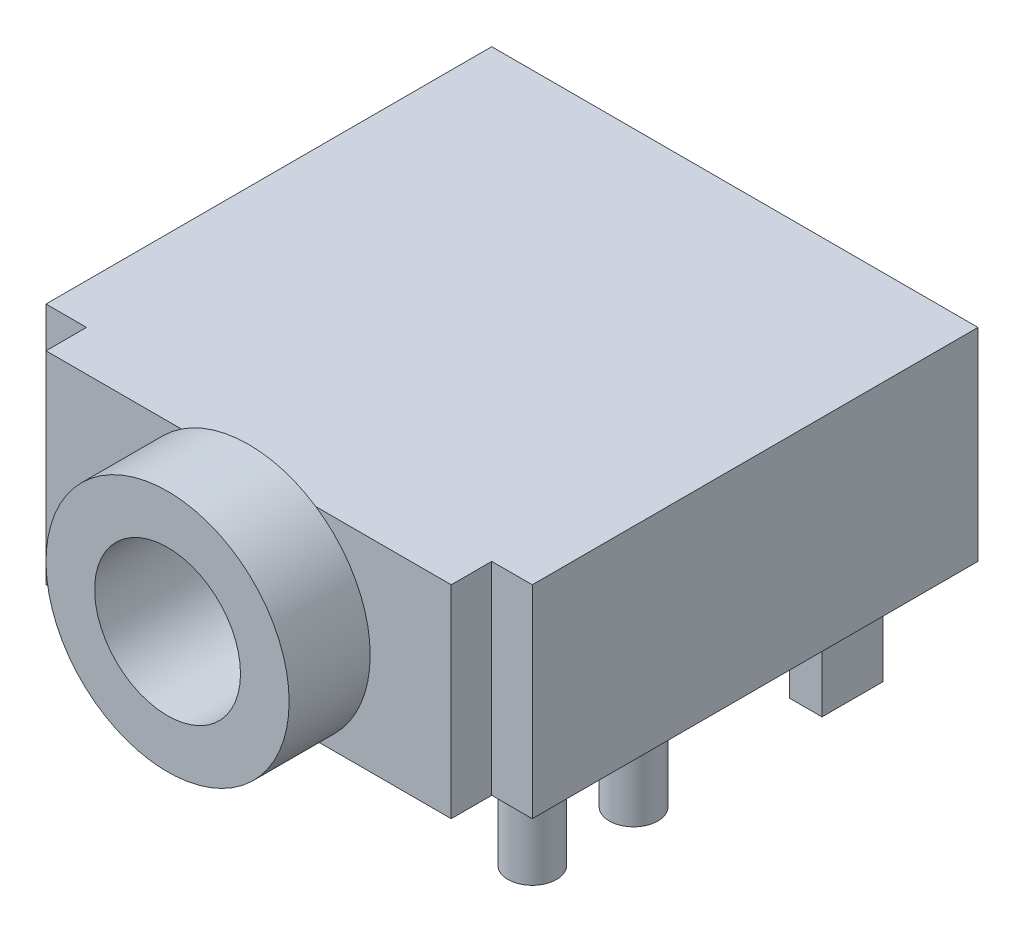
from build123d import *

# Parameters (mm, degrees)
SKETCH_1_W          = 12
SKETCH_1_H          = 5
EXTRUDE_1_DEPTH     = 11
SKETCH_2_R          = 0.6
EXTRUDE_2_DEPTH     = 2
EXTRUDE_2_2_DEPTH   = 2
EXTRUDE_2_3_DEPTH   = 2
EXTRUDE_2_4_DEPTH   = 2
SKETCH_2_W          = 0.8
SKETCH_2_H          = 1.5
EXTRUDE_2_5_DEPTH   = 2
EXTRUDE_2_6_DEPTH   = 2
SKETCH_2_W_2        = 1.5
SKETCH_2_H_2        = 0.8
EXTRUDE_2_7_DEPTH   = 2
EXTRUDE_2_8_DEPTH   = 2
EXTRUDE_2_9_DEPTH   = 2
SKETCH_3_W          = 10
SKETCH_3_H          = 5
EXTRUDE_3_DEPTH     = 1
SKETCH_4_R          = 3
EXTRUDE_4_DEPTH     = 2
SKETCH_5_R          = 1.8
CUT_EXTRUDE_1_DEPTH = 14


with BuildPart() as part:
    # Эскиз1 → Бобышка-Вытянуть1 (new body)
    with BuildSketch(Plane.XY):
        with Locations((0, 2.5)):
            Rectangle(SKETCH_1_W, SKETCH_1_H)
    extrude(amount=EXTRUDE_1_DEPTH)

    # Эскиз3 → Бобышка-Вытянуть3 (add)
    with BuildSketch(Plane.XY.offset(11)):
        with Locations((0, 2.5)):
            Rectangle(SKETCH_3_W, SKETCH_3_H)
    extrude(amount=EXTRUDE_3_DEPTH)

    # Эскиз4 → Бобышка-Вытянуть4 (add)
    with BuildSketch(Plane.XY.offset(12)):
        with Locations(Location((0, 2.5, 0), (0, 0, 123.557309762))):
            Circle(SKETCH_4_R)
    extrude(amount=EXTRUDE_4_DEPTH)

    # Эскиз5 → Вырез-Вытянуть1 (cut)
    with BuildSketch(Plane.XY.offset(14)):
        with Locations((0, 2.5)):
            Circle(SKETCH_5_R)
    extrude(amount=-CUT_EXTRUDE_1_DEPTH, mode=Mode.SUBTRACT)


with BuildPart() as body_2:
    # Эскиз2 → Бобышка-Вытянуть2 (new body)
    with BuildSketch(Plane(origin=(0, 0, 0), x_dir=(1, 0, 0), z_dir=(0, 1, 0))):
        with Locations(Location((5, -10, 0), (0, 0, 270))):
            Circle(SKETCH_2_R)
    extrude(amount=-EXTRUDE_2_DEPTH)


with BuildPart() as body_3:
    # Эскиз2 → Extrude 2 2 (new body)
    with BuildSketch(Plane(origin=(0, 0, 0), x_dir=(1, 0, 0), z_dir=(0, 1, 0))):
        with Locations(Location((5, -7.5, 0), (0, 0, 270))):
            Circle(SKETCH_2_R)
    extrude(amount=-EXTRUDE_2_2_DEPTH)


with BuildPart() as body_4:
    # Эскиз2 → Extrude 2 3 (new body)
    with BuildSketch(Plane(origin=(0, 0, 0), x_dir=(1, 0, 0), z_dir=(0, 1, 0))):
        with Locations(Location((-5, -10, 0), (0, 0, 90))):
            Circle(SKETCH_2_R)
    extrude(amount=-EXTRUDE_2_3_DEPTH)


with BuildPart() as body_5:
    # Эскиз2 → Extrude 2 4 (new body)
    with BuildSketch(Plane(origin=(0, 0, 0), x_dir=(1, 0, 0), z_dir=(0, 1, 0))):
        with Locations(Location((-5, -7.5, 0), (0, 0, 90))):
            Circle(SKETCH_2_R)
    extrude(amount=-EXTRUDE_2_4_DEPTH)


with BuildPart() as body_6:
    # Эскиз2 → Extrude 2 5 (new body)
    with BuildSketch(Plane(origin=(0, 0, 0), x_dir=(1, 0, 0), z_dir=(0, 1, 0))):
        with Locations((5, -2.5)):
            Rectangle(SKETCH_2_W, SKETCH_2_H)
    extrude(amount=-EXTRUDE_2_5_DEPTH)


with BuildPart() as body_7:
    # Эскиз2 → Extrude 2 6 (new body)
    with BuildSketch(Plane(origin=(0, 0, 0), x_dir=(1, 0, 0), z_dir=(0, 1, 0))):
        with Locations((2.5, -2.5)):
            Rectangle(SKETCH_2_W, SKETCH_2_H)
    extrude(amount=-EXTRUDE_2_6_DEPTH)


with BuildPart() as body_8:
    # Эскиз2 → Extrude 2 7 (new body)
    with BuildSketch(Plane(origin=(0, 0, 0), x_dir=(1, 0, 0), z_dir=(0, 1, 0))):
        with Locations((0, -7.5)):
            Rectangle(SKETCH_2_W_2, SKETCH_2_H_2)
    extrude(amount=-EXTRUDE_2_7_DEPTH)


with BuildPart() as body_9:
    # Эскиз2 → Extrude 2 8 (new body)
    with BuildSketch(Plane(origin=(0, 0, 0), x_dir=(1, 0, 0), z_dir=(0, 1, 0))):
        with Locations((-2.5, -2.5)):
            Rectangle(SKETCH_2_W, SKETCH_2_H)
    extrude(amount=-EXTRUDE_2_8_DEPTH)


with BuildPart() as body_10:
    # Эскиз2 → Extrude 2 9 (new body)
    with BuildSketch(Plane(origin=(0, 0, 0), x_dir=(1, 0, 0), z_dir=(0, 1, 0))):
        with Locations((-5, -2.5)):
            Rectangle(SKETCH_2_W, SKETCH_2_H)
    extrude(amount=-EXTRUDE_2_9_DEPTH)


solid = Compound([part.part, body_2.part, body_3.part, body_4.part, body_5.part, body_6.part, body_7.part, body_8.part, body_9.part, body_10.part])
